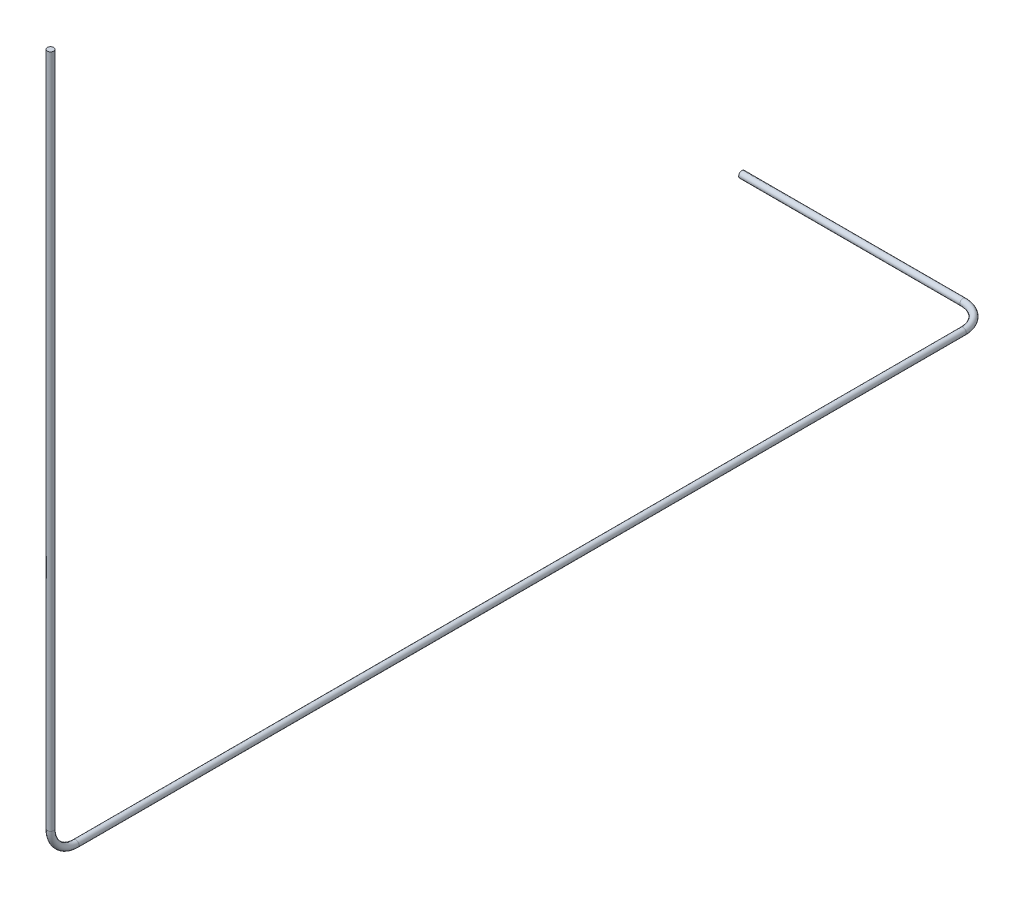
from build123d import *

# Parameters (mm, degrees)
BARRER3_PROFILE_R = 6.35


with BuildPart() as part:
    # Barrer3: sweep along a curve in space
    with BuildLine() as barrer3_path:
        Line((99.462798079, -956.74763274, 1866.72), (537.020499739, -956.74763274, 1866.72))
        ThreePointArc((537.020499739, -956.74763274, 1866.72), (572.375838799, -956.74763274, 1881.364660941), (587.020499739, -956.74763274, 1916.72))
        Line((587.020499739, -956.74763274, 1916.72), (587.020499739, -956.74763274, 3672.090203728))
        ThreePointArc((587.020499739, -956.74763274, 3672.090203728), (587.020499739, -942.102971799, 3707.445542787), (587.020499739, -906.74763274, 3722.090203728))
        Line((587.020499739, -906.74763274, 3722.090203728), (587.020499739, 428.812094771, 3722.090203728))
    # Barrer3 profile (on start of the path) → Barrer3 (sweep)
    with BuildSketch(Plane(origin=(99.462798079, -956.74763274, 1866.72), x_dir=(0, 1, 0), z_dir=(1, 0, 0))):
        Circle(BARRER3_PROFILE_R)
    sweep(path=barrer3_path.line)


solid = part.part
